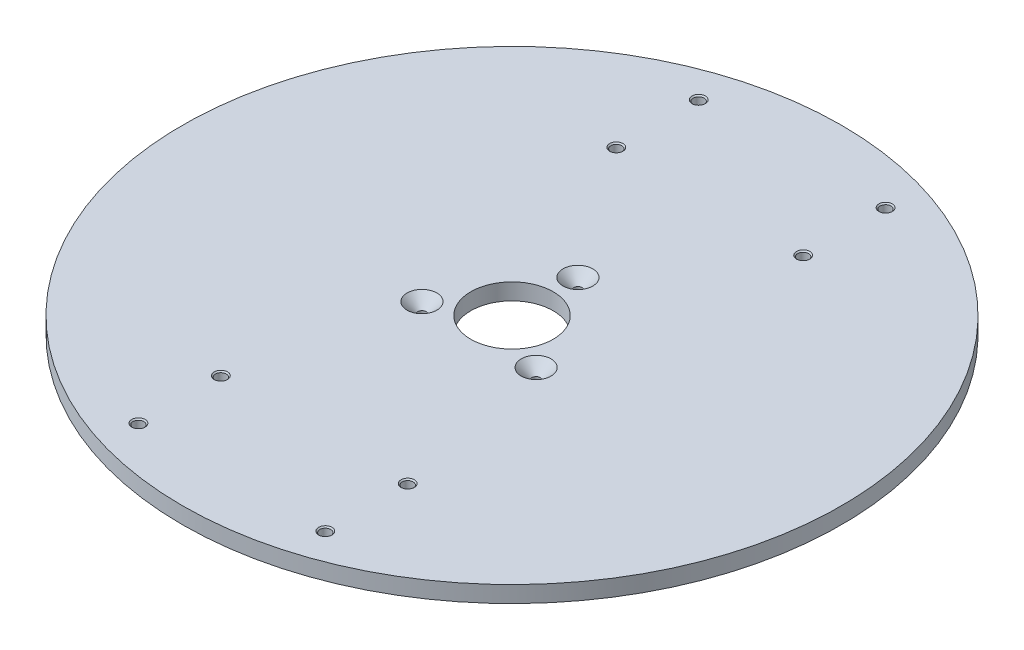
from build123d import *

# Parameters (mm, degrees)
SKETCH_1_R                   = 100
EXTRUDE_1_DEPTH              = 5
HOLE_WIZARD_M3_1_D           = 2.5
HOLE_WIZARD_M3_1_CSINK_D     = 9.05
HOLE_WIZARD_M3_1_CSINK_ANGLE = 90
SKETCH_5_R                   = 12.5
CUT_EXTRUDE_1_DEPTH          = 142.509716981
HOLE_WIZARD_M4_2_D           = 3.3
HOLE_WIZARD_M4_2_DEPTH       = 5
HOLE_WIZARD_M4_2_CSINK_D     = 4.05
HOLE_WIZARD_M4_2_CSINK_ANGLE = 90


with BuildPart() as part:
    # 草图1 → 凸台-拉伸1 (new body)
    with BuildSketch(Plane(origin=(0, 0, 0), x_dir=(1, 0, 0), z_dir=(0, 1, 0))):
        with Locations(Location((0, 0, 0), (0, 0, 270))):
            Circle(SKETCH_1_R)
    extrude(amount=EXTRUDE_1_DEPTH)

    # M3 螺纹孔1 (through all)
    with Locations(Plane(origin=(0, 5, 0), x_dir=(1, 0, 0), z_dir=(0, 1, 0))):
        with Locations((0, 20), (17.320508076, -10), (-17.320508076, -10)):
            CounterSinkHole(HOLE_WIZARD_M3_1_D / 2, HOLE_WIZARD_M3_1_CSINK_D / 2, counter_sink_angle=HOLE_WIZARD_M3_1_CSINK_ANGLE)

    # 草图5 → 切除-拉伸1 (cut, through all)
    with BuildSketch(Plane(origin=(0, 5, 0), x_dir=(1, 0, 0), z_dir=(0, 1, 0))):
        with Locations(Location((0, 0, 0), (0, 0, 270))):
            Circle(SKETCH_5_R)
    extrude(amount=-CUT_EXTRUDE_1_DEPTH, mode=Mode.SUBTRACT)

    # M4 螺纹孔2
    with Locations(Plane(origin=(0, 5, 0), x_dir=(1, 0, 0), z_dir=(0, 1, 0))):
        with Locations((0, 0), (-28.35, 85), (28.35, 85), (28.35, -85), (-28.35, -85), (-28.35, 60), (28.35, 60), (-28.35, -60), (28.35, -60)):
            CounterSinkHole(HOLE_WIZARD_M4_2_D / 2, HOLE_WIZARD_M4_2_CSINK_D / 2, depth=HOLE_WIZARD_M4_2_DEPTH, counter_sink_angle=HOLE_WIZARD_M4_2_CSINK_ANGLE)


solid = part.part
